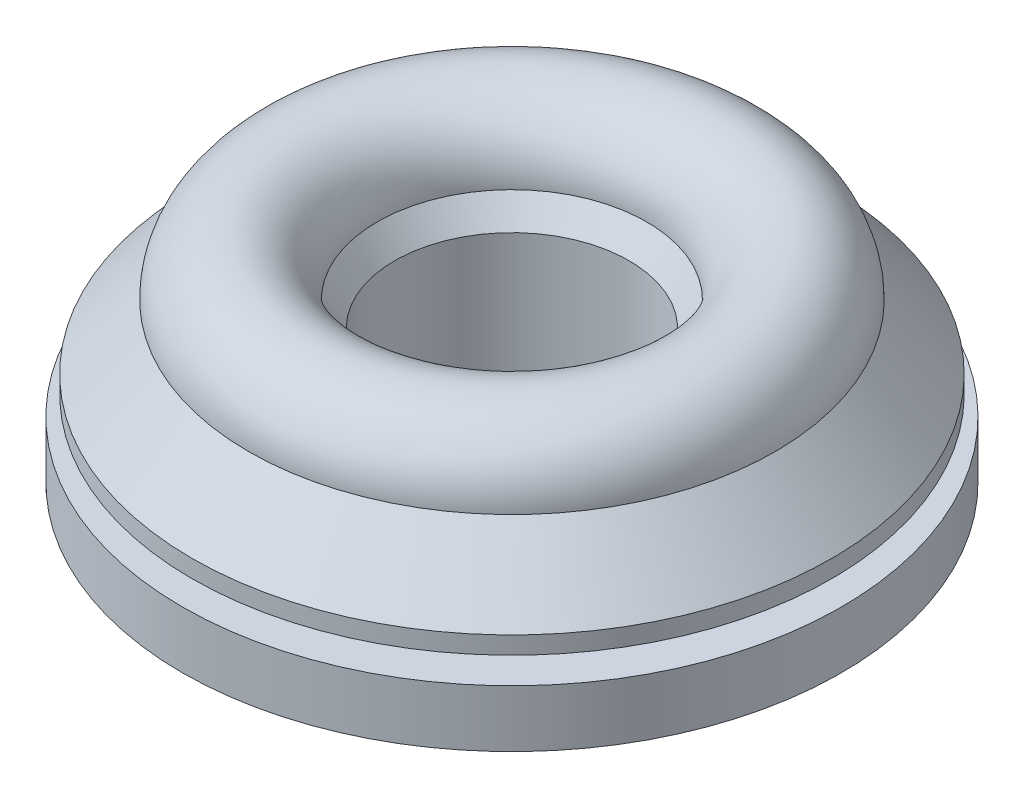
from build123d import *


with BuildPart() as part:
    # Sketch1 → Revolve1 (revolve)
    with BuildSketch(Plane.XY, mode=Mode.PRIVATE) as revolve1_sk:
        with BuildLine():
            Line((8.763, 5.9563), (7.62, 4.3434))
            Line((7.62, 4.3434), (7.62, -4.3434))
            Line((7.62, -4.3434), (21.43125, -4.3434))
            Line((21.43125, -4.3434), (21.43125, -0.635))
            Line((21.43125, -0.635), (17.4625, -0.635))
            Line((17.4625, -0.635), (17.4625, 0.635))
            Line((17.4625, 0.635), (20.79625, 0.635))
            Line((20.79625, 0.635), (20.79625, 1.778))
            Line((20.79625, 1.778), (17.1196, 5.9563))
            ThreePointArc((17.1196, 5.9563), (12.9413, 10.1346), (8.763, 5.9563))
        make_face()
    revolve(revolve1_sk.sketch.rotate(Axis((0, 10.1346, 0), (0, -1, 0)), 90), axis=Axis((0, 10.1346, 0), (0, -1, 0)))


solid = part.part
